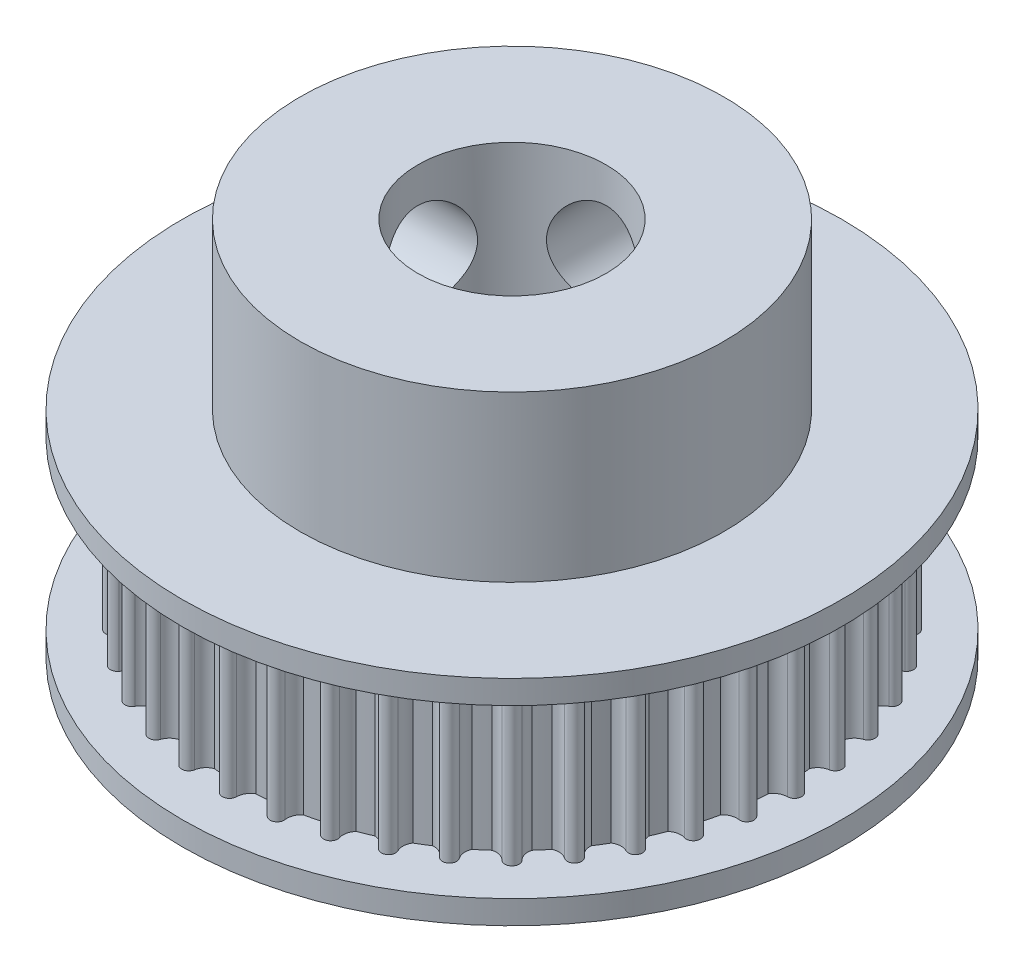
from build123d import *

# Parameters (mm, degrees)
SKETCH2_R               = 14
SKETCH2_R_2             = 4
BOSS_EXTRUDE1_DEPTH     = 15.5
CUT_EXTRUDE1_START      = -8.1
SKETCH3_R               = 14
CUT_EXTRUDE1_DEPTH      = 7.1
CUT_EXTRUDE2_REACH      = 27.145
CUT_EXTRUDE2_END_RADIUS = 14
SKETCH4_R               = 2
CUT_EXTRUDE3_REACH      = 27.145
CUT_EXTRUDE3_END_RADIUS = 14
SKETCH5_R               = 2
SKETCH6_R               = 9
SKETCH6_R_2             = 4
BOSS_EXTRUDE2_DEPTH     = 7
CUT_EXTRUDE4_REACH      = 31.971
CUT_EXTRUDE4_END_RADIUS = 9
SKETCH7_R               = 2
CUT_EXTRUDE5_REACH      = 31.971
CUT_EXTRUDE5_END_RADIUS = 9
SKETCH8_R               = 2
SKETCH9_R               = 14
CUT_EXTRUDE6_DEPTH      = 6.4


with BuildPart() as part:
    # Sketch2 → Boss-Extrude1 (new body)
    with BuildSketch(Plane(origin=(0, 0, 0), x_dir=(1, 0, 0), z_dir=(0, 1, 0))):
        with Locations(Location((0, 0, 0), (0, 0, 270))):
            Circle(SKETCH2_R)
        with Locations(Location((0, 0, 0), (0, 0, 270))):
            Circle(SKETCH2_R_2, mode=Mode.SUBTRACT)
    extrude(amount=BOSS_EXTRUDE1_DEPTH)

    # Sketch3 → Cut-Extrude1 (cut)
    with BuildSketch(Plane(origin=(0, 15.5, 0), x_dir=(1, 0, 0), z_dir=(0, 1, 0)).offset(CUT_EXTRUDE1_START)):
        with Locations(Location((0, 0, 0), (0, 0, 270))):
            Circle(SKETCH3_R)
        with BuildLine():
            ThreePointArc((-0.3, 12.001318591), (0, 12.300002898), (0.3, 12.001318591))
            ThreePointArc((0.3, 12.001318591), (0.381041187, 11.702811653), (0.6, 11.48433716))
            ThreePointArc((0.6, 11.48433716), (0.902279601, 11.464549338), (1.203933136, 11.436806591))
            ThreePointArc((1.203933136, 11.436806591), (1.454373143, 11.618338596), (1.581113351, 11.900492784))
            ThreePointArc((1.581113351, 11.900492784), (1.924144373, 12.148569451), (2.173726356, 11.806632105))
            ThreePointArc((2.173726356, 11.806632105), (2.207073018, 11.499122648), (2.389159144, 11.249085233))
            ThreePointArc((2.389159144, 11.249085233), (2.684621684, 11.182254085), (2.978221442, 11.107663888))
            ThreePointArc((2.978221442, 11.107663888), (3.253975979, 11.247783484), (3.423294445, 11.506637349))
            ThreePointArc((3.423294445, 11.506637349), (3.800909926, 11.697997906), (3.993928354, 11.321227152))
            ThreePointArc((3.993928354, 11.321227152), (3.978759387, 11.012287079), (4.119489261, 10.736843495))
            ThreePointArc((4.119489261, 10.736843495), (4.400859472, 10.624614624), (4.679176052, 10.505013635))
            ThreePointArc((4.679176052, 10.505013635), (4.973455127, 10.600270613), (5.181182667, 10.829450314))
            ThreePointArc((5.181182667, 10.829450314), (5.584084462, 10.959382829), (5.715786582, 10.557056014))
            ThreePointArc((5.715786582, 10.557056014), (5.652475495, 10.254292455), (5.748383881, 9.960225036))
            ThreePointArc((5.748383881, 9.960225036), (6.008733494, 9.80536189), (6.264913818, 9.643695083))
            ThreePointArc((6.264913818, 9.643695083), (6.570471304, 9.6917439), (6.811492978, 9.885606271))
            ThreePointArc((6.811492978, 9.885606271), (7.229760306, 9.950911375), (7.296903174, 9.532935119))
            ThreePointArc((7.296903174, 9.532935119), (7.187008896, 9.243803119), (7.235734212, 8.93835278))
            ThreePointArc((7.235734212, 8.93835278), (7.468652556, 8.744668604), (7.696388614, 8.544916752))
            ThreePointArc((7.696388614, 8.544916752), (8.005700672, 8.544574286), (8.274081725, 8.698345793))
            ThreePointArc((8.274081725, 8.698345793), (8.697415458, 8.697415458), (8.698345793, 8.274081725))
            ThreePointArc((8.698345793, 8.274081725), (8.544574286, 8.005700672), (8.544916752, 7.696388614))
            ThreePointArc((8.544916752, 7.696388614), (8.744668604, 7.468652556), (8.93835278, 7.235734212))
            ThreePointArc((8.93835278, 7.235734212), (9.243803119, 7.187008896), (9.532935119, 7.296903174))
            ThreePointArc((9.532935119, 7.296903174), (9.950911375, 7.229760306), (9.885606271, 6.811492978))
            ThreePointArc((9.885606271, 6.811492978), (9.6917439, 6.570471304), (9.643695083, 6.264913818))
            ThreePointArc((9.643695083, 6.264913818), (9.80536189, 6.008733494), (9.960225036, 5.748383881))
            ThreePointArc((9.960225036, 5.748383881), (10.254292455, 5.652475495), (10.557056014, 5.715786582))
            ThreePointArc((10.557056014, 5.715786582), (10.959382829, 5.584084462), (10.829450314, 5.181182667))
            ThreePointArc((10.829450314, 5.181182667), (10.600270613, 4.973455127), (10.505013635, 4.679176052))
            ThreePointArc((10.505013635, 4.679176052), (10.624614624, 4.400859472), (10.736843495, 4.119489261))
            ThreePointArc((10.736843495, 4.119489261), (11.012287079, 3.978759387), (11.321227152, 3.993928354))
            ThreePointArc((11.321227152, 3.993928354), (11.697997906, 3.800909926), (11.506637349, 3.423294445))
            ThreePointArc((11.506637349, 3.423294445), (11.247783484, 3.253975979), (11.107663888, 2.978221442))
            ThreePointArc((11.107663888, 2.978221442), (11.182254085, 2.684621684), (11.249085233, 2.389159144))
            ThreePointArc((11.249085233, 2.389159144), (11.499122648, 2.207073018), (11.806632105, 2.173726356))
            ThreePointArc((11.806632105, 2.173726356), (12.148569451, 1.924144373), (11.900492784, 1.581113351))
            ThreePointArc((11.900492784, 1.581113351), (11.618338596, 1.454373143), (11.436806591, 1.203933136))
            ThreePointArc((11.436806591, 1.203933136), (11.464549338, 0.902279601), (11.48433716, 0.6))
            ThreePointArc((11.48433716, 0.6), (11.702811653, 0.381041187), (12.001318591, 0.3))
            ThreePointArc((12.001318591, 0.3), (12.300002898, 0), (12.001318591, -0.3))
            ThreePointArc((12.001318591, -0.3), (11.702811653, -0.381041187), (11.48433716, -0.6))
            ThreePointArc((11.48433716, -0.6), (11.464549338, -0.902279601), (11.436806591, -1.203933136))
            ThreePointArc((11.436806591, -1.203933136), (11.618338596, -1.454373143), (11.900492784, -1.581113351))
            ThreePointArc((11.900492784, -1.581113351), (12.148569451, -1.924144373), (11.806632105, -2.173726356))
            ThreePointArc((11.806632105, -2.173726356), (11.499122648, -2.207073018), (11.249085233, -2.389159144))
            ThreePointArc((11.249085233, -2.389159144), (11.182254085, -2.684621684), (11.107663888, -2.978221442))
            ThreePointArc((11.107663888, -2.978221442), (11.247783484, -3.253975979), (11.506637349, -3.423294445))
            ThreePointArc((11.506637349, -3.423294445), (11.697997906, -3.800909926), (11.321227152, -3.993928354))
            ThreePointArc((11.321227152, -3.993928354), (11.012287079, -3.978759387), (10.736843495, -4.119489261))
            ThreePointArc((10.736843495, -4.119489261), (10.624614624, -4.400859472), (10.505013635, -4.679176052))
            ThreePointArc((10.505013635, -4.679176052), (10.600270613, -4.973455127), (10.829450314, -5.181182667))
            ThreePointArc((10.829450314, -5.181182667), (10.959382829, -5.584084462), (10.557056014, -5.715786582))
            ThreePointArc((10.557056014, -5.715786582), (10.254292455, -5.652475495), (9.960225036, -5.748383881))
            ThreePointArc((9.960225036, -5.748383881), (9.80536189, -6.008733494), (9.643695083, -6.264913818))
            ThreePointArc((9.643695083, -6.264913818), (9.6917439, -6.570471304), (9.885606271, -6.811492978))
            ThreePointArc((9.885606271, -6.811492978), (9.950911375, -7.229760306), (9.532935119, -7.296903174))
            ThreePointArc((9.532935119, -7.296903174), (9.243803119, -7.187008896), (8.93835278, -7.235734212))
            ThreePointArc((8.93835278, -7.235734212), (8.744668604, -7.468652556), (8.544916752, -7.696388614))
            ThreePointArc((8.544916752, -7.696388614), (8.544574286, -8.005700672), (8.698345793, -8.274081725))
            ThreePointArc((8.698345793, -8.274081725), (8.697415458, -8.697415458), (8.274081725, -8.698345793))
            ThreePointArc((8.274081725, -8.698345793), (8.005700672, -8.544574286), (7.696388614, -8.544916752))
            ThreePointArc((7.696388614, -8.544916752), (7.468652556, -8.744668604), (7.235734212, -8.93835278))
            ThreePointArc((7.235734212, -8.93835278), (7.187008896, -9.243803119), (7.296903174, -9.532935119))
            ThreePointArc((7.296903174, -9.532935119), (7.229760306, -9.950911375), (6.811492978, -9.885606271))
            ThreePointArc((6.811492978, -9.885606271), (6.570471304, -9.6917439), (6.264913818, -9.643695083))
            ThreePointArc((6.264913818, -9.643695083), (6.008733494, -9.80536189), (5.748383881, -9.960225036))
            ThreePointArc((5.748383881, -9.960225036), (5.652475495, -10.254292455), (5.715786582, -10.557056014))
            ThreePointArc((5.715786582, -10.557056014), (5.584084462, -10.959382829), (5.181182667, -10.829450314))
            ThreePointArc((5.181182667, -10.829450314), (4.973455127, -10.600270613), (4.679176052, -10.505013635))
            ThreePointArc((4.679176052, -10.505013635), (4.400859472, -10.624614624), (4.119489261, -10.736843495))
            ThreePointArc((4.119489261, -10.736843495), (3.978759387, -11.012287079), (3.993928354, -11.321227152))
            ThreePointArc((3.993928354, -11.321227152), (3.800909926, -11.697997906), (3.423294445, -11.506637349))
            ThreePointArc((3.423294445, -11.506637349), (3.253975979, -11.247783484), (2.978221442, -11.107663888))
            ThreePointArc((2.978221442, -11.107663888), (2.684621684, -11.182254085), (2.389159144, -11.249085233))
            ThreePointArc((2.389159144, -11.249085233), (2.207073018, -11.499122648), (2.173726356, -11.806632105))
            ThreePointArc((2.173726356, -11.806632105), (1.924144373, -12.148569451), (1.581113351, -11.900492784))
            ThreePointArc((1.581113351, -11.900492784), (1.454373143, -11.618338596), (1.203933136, -11.436806591))
            ThreePointArc((1.203933136, -11.436806591), (0.902279601, -11.464549338), (0.6, -11.48433716))
            ThreePointArc((0.6, -11.48433716), (0.381041187, -11.702811653), (0.3, -12.001318591))
            ThreePointArc((0.3, -12.001318591), (0, -12.300002898), (-0.3, -12.001318591))
            ThreePointArc((-0.3, -12.001318591), (-0.381041187, -11.702811653), (-0.6, -11.48433716))
            ThreePointArc((-0.6, -11.48433716), (-0.902279601, -11.464549338), (-1.203933136, -11.436806591))
            ThreePointArc((-1.203933136, -11.436806591), (-1.454373143, -11.618338596), (-1.581113351, -11.900492784))
            ThreePointArc((-1.581113351, -11.900492784), (-1.924144373, -12.148569451), (-2.173726356, -11.806632105))
            ThreePointArc((-2.173726356, -11.806632105), (-2.207073018, -11.499122648), (-2.389159144, -11.249085233))
            ThreePointArc((-2.389159144, -11.249085233), (-2.684621684, -11.182254085), (-2.978221442, -11.107663888))
            ThreePointArc((-2.978221442, -11.107663888), (-3.253975979, -11.247783484), (-3.423294445, -11.506637349))
            ThreePointArc((-3.423294445, -11.506637349), (-3.800909926, -11.697997906), (-3.993928354, -11.321227152))
            ThreePointArc((-3.993928354, -11.321227152), (-3.978759387, -11.012287079), (-4.119489261, -10.736843495))
            ThreePointArc((-4.119489261, -10.736843495), (-4.400859472, -10.624614624), (-4.679176052, -10.505013635))
            ThreePointArc((-4.679176052, -10.505013635), (-4.973455127, -10.600270613), (-5.181182667, -10.829450314))
            ThreePointArc((-5.181182667, -10.829450314), (-5.584084462, -10.959382829), (-5.715786582, -10.557056014))
            ThreePointArc((-5.715786582, -10.557056014), (-5.652475495, -10.254292455), (-5.748383881, -9.960225036))
            ThreePointArc((-5.748383881, -9.960225036), (-6.008733494, -9.80536189), (-6.264913818, -9.643695083))
            ThreePointArc((-6.264913818, -9.643695083), (-6.570471304, -9.6917439), (-6.811492978, -9.885606271))
            ThreePointArc((-6.811492978, -9.885606271), (-7.229760306, -9.950911375), (-7.296903174, -9.532935119))
            ThreePointArc((-7.296903174, -9.532935119), (-7.187008896, -9.243803119), (-7.235734212, -8.93835278))
            ThreePointArc((-7.235734212, -8.93835278), (-7.468652556, -8.744668604), (-7.696388614, -8.544916752))
            ThreePointArc((-7.696388614, -8.544916752), (-8.005700672, -8.544574286), (-8.274081725, -8.698345793))
            ThreePointArc((-8.274081725, -8.698345793), (-8.697415458, -8.697415458), (-8.698345793, -8.274081725))
            ThreePointArc((-8.698345793, -8.274081725), (-8.544574286, -8.005700672), (-8.544916752, -7.696388614))
            ThreePointArc((-8.544916752, -7.696388614), (-8.744668604, -7.468652556), (-8.93835278, -7.235734212))
            ThreePointArc((-8.93835278, -7.235734212), (-9.243803119, -7.187008896), (-9.532935119, -7.296903174))
            ThreePointArc((-9.532935119, -7.296903174), (-9.950911375, -7.229760306), (-9.885606271, -6.811492978))
            ThreePointArc((-9.885606271, -6.811492978), (-9.6917439, -6.570471304), (-9.643695083, -6.264913818))
            ThreePointArc((-9.643695083, -6.264913818), (-9.80536189, -6.008733494), (-9.960225036, -5.748383881))
            ThreePointArc((-9.960225036, -5.748383881), (-10.254292455, -5.652475495), (-10.557056014, -5.715786582))
            ThreePointArc((-10.557056014, -5.715786582), (-10.959382829, -5.584084462), (-10.829450314, -5.181182667))
            ThreePointArc((-10.829450314, -5.181182667), (-10.600270613, -4.973455127), (-10.505013635, -4.679176052))
            ThreePointArc((-10.505013635, -4.679176052), (-10.624614624, -4.400859472), (-10.736843495, -4.119489261))
            ThreePointArc((-10.736843495, -4.119489261), (-11.012287079, -3.978759387), (-11.321227152, -3.993928354))
            ThreePointArc((-11.321227152, -3.993928354), (-11.697997906, -3.800909926), (-11.506637349, -3.423294445))
            ThreePointArc((-11.506637349, -3.423294445), (-11.247783484, -3.253975979), (-11.107663888, -2.978221442))
            ThreePointArc((-11.107663888, -2.978221442), (-11.182254085, -2.684621684), (-11.249085233, -2.389159144))
            ThreePointArc((-11.249085233, -2.389159144), (-11.499122648, -2.207073018), (-11.806632105, -2.173726356))
            ThreePointArc((-11.806632105, -2.173726356), (-12.148569451, -1.924144373), (-11.900492784, -1.581113351))
            ThreePointArc((-11.900492784, -1.581113351), (-11.618338596, -1.454373143), (-11.436806591, -1.203933136))
            ThreePointArc((-11.436806591, -1.203933136), (-11.464549338, -0.902279601), (-11.48433716, -0.6))
            ThreePointArc((-11.48433716, -0.6), (-11.702811653, -0.381041187), (-12.001318591, -0.3))
            ThreePointArc((-12.001318591, -0.3), (-12.300002898, 0), (-12.001318591, 0.3))
            ThreePointArc((-12.001318591, 0.3), (-11.702811653, 0.381041187), (-11.48433716, 0.6))
            ThreePointArc((-11.48433716, 0.6), (-11.464549338, 0.902279601), (-11.436806591, 1.203933136))
            ThreePointArc((-11.436806591, 1.203933136), (-11.618338596, 1.454373143), (-11.900492784, 1.581113351))
            ThreePointArc((-11.900492784, 1.581113351), (-12.148569451, 1.924144373), (-11.806632105, 2.173726356))
            ThreePointArc((-11.806632105, 2.173726356), (-11.499122648, 2.207073018), (-11.249085233, 2.389159144))
            ThreePointArc((-11.249085233, 2.389159144), (-11.182254085, 2.684621684), (-11.107663888, 2.978221442))
            ThreePointArc((-11.107663888, 2.978221442), (-11.247783484, 3.253975979), (-11.506637349, 3.423294445))
            ThreePointArc((-11.506637349, 3.423294445), (-11.697997906, 3.800909926), (-11.321227152, 3.993928354))
            ThreePointArc((-11.321227152, 3.993928354), (-11.012287079, 3.978759387), (-10.736843495, 4.119489261))
            ThreePointArc((-10.736843495, 4.119489261), (-10.624614624, 4.400859472), (-10.505013635, 4.679176052))
            ThreePointArc((-10.505013635, 4.679176052), (-10.600270613, 4.973455127), (-10.829450314, 5.181182667))
            ThreePointArc((-10.829450314, 5.181182667), (-10.959382829, 5.584084462), (-10.557056014, 5.715786582))
            ThreePointArc((-10.557056014, 5.715786582), (-10.254292455, 5.652475495), (-9.960225036, 5.748383881))
            ThreePointArc((-9.960225036, 5.748383881), (-9.80536189, 6.008733494), (-9.643695083, 6.264913818))
            ThreePointArc((-9.643695083, 6.264913818), (-9.6917439, 6.570471304), (-9.885606271, 6.811492978))
            ThreePointArc((-9.885606271, 6.811492978), (-9.950911375, 7.229760306), (-9.532935119, 7.296903174))
            ThreePointArc((-9.532935119, 7.296903174), (-9.243803119, 7.187008896), (-8.93835278, 7.235734212))
            ThreePointArc((-8.93835278, 7.235734212), (-8.744668604, 7.468652556), (-8.544916752, 7.696388614))
            ThreePointArc((-8.544916752, 7.696388614), (-8.544574286, 8.005700672), (-8.698345793, 8.274081725))
            ThreePointArc((-8.698345793, 8.274081725), (-8.697415458, 8.697415458), (-8.274081725, 8.698345793))
            ThreePointArc((-8.274081725, 8.698345793), (-8.005700672, 8.544574286), (-7.696388614, 8.544916752))
            ThreePointArc((-7.696388614, 8.544916752), (-7.468652556, 8.744668604), (-7.235734212, 8.93835278))
            ThreePointArc((-7.235734212, 8.93835278), (-7.187008896, 9.243803119), (-7.296903174, 9.532935119))
            ThreePointArc((-7.296903174, 9.532935119), (-7.229760306, 9.950911375), (-6.811492978, 9.885606271))
            ThreePointArc((-6.811492978, 9.885606271), (-6.570471304, 9.6917439), (-6.264913818, 9.643695083))
            ThreePointArc((-6.264913818, 9.643695083), (-6.008733494, 9.80536189), (-5.748383881, 9.960225036))
            ThreePointArc((-5.748383881, 9.960225036), (-5.652475495, 10.254292455), (-5.715786582, 10.557056014))
            ThreePointArc((-5.715786582, 10.557056014), (-5.584084462, 10.959382829), (-5.181182667, 10.829450314))
            ThreePointArc((-5.181182667, 10.829450314), (-4.973455127, 10.600270613), (-4.679176052, 10.505013635))
            ThreePointArc((-4.679176052, 10.505013635), (-4.400859472, 10.624614624), (-4.119489261, 10.736843495))
            ThreePointArc((-4.119489261, 10.736843495), (-3.978759387, 11.012287079), (-3.993928354, 11.321227152))
            ThreePointArc((-3.993928354, 11.321227152), (-3.800909926, 11.697997906), (-3.423294445, 11.506637349))
            ThreePointArc((-3.423294445, 11.506637349), (-3.253975979, 11.247783484), (-2.978221442, 11.107663888))
            ThreePointArc((-2.978221442, 11.107663888), (-2.684621684, 11.182254085), (-2.389159144, 11.249085233))
            ThreePointArc((-2.389159144, 11.249085233), (-2.207073018, 11.499122648), (-2.173726356, 11.806632105))
            ThreePointArc((-2.173726356, 11.806632105), (-1.924144373, 12.148569451), (-1.581113351, 11.900492784))
            ThreePointArc((-1.581113351, 11.900492784), (-1.454373143, 11.618338596), (-1.203933136, 11.436806591))
            ThreePointArc((-1.203933136, 11.436806591), (-0.902279601, 11.464549338), (-0.6, 11.48433716))
            ThreePointArc((-0.6, 11.48433716), (-0.381041187, 11.702811653), (-0.3, 12.001318591))
        make_face(mode=Mode.SUBTRACT)
    extrude(amount=CUT_EXTRUDE1_DEPTH, mode=Mode.SUBTRACT)

    # Cut-Extrude2: up to this cylinder (the profile starts inside it)
    cut_extrude2_end = Plane(origin=(0, 3.75, 0), z_dir=(0, -1, 0)) * Cylinder(CUT_EXTRUDE2_END_RADIUS, 83.29, mode=Mode.PRIVATE)
    # Sketch4 → Cut-Extrude2 (cut, up to the surface)
    with BuildSketch(Plane.XY, mode=Mode.PRIVATE) as cut_extrude2_sk1:
        with Locations((0, 3.75)):
            Circle(SKETCH4_R)
    cut_extrude2_tool1 = extrude(cut_extrude2_sk1.sketch, amount=-CUT_EXTRUDE2_REACH, mode=Mode.PRIVATE) & cut_extrude2_end
    add(cut_extrude2_tool1.solids().sort_by_distance((0, 3.75, 0))[0], mode=Mode.SUBTRACT)

    # Cut-Extrude3: up to this cylinder (the profile starts inside it)
    cut_extrude3_end = Plane(origin=(0, 3.75, 0), z_dir=(0, -1, 0)) * Cylinder(CUT_EXTRUDE3_END_RADIUS, 83.29, mode=Mode.PRIVATE)
    # Sketch5 → Cut-Extrude3 (cut, up to the surface)
    with BuildSketch(Plane(origin=(0, 0, 0), x_dir=(0, 0, -1), z_dir=(1, 0, 0)), mode=Mode.PRIVATE) as cut_extrude3_sk1:
        with Locations((0, 3.75)):
            Circle(SKETCH5_R)
    cut_extrude3_tool1 = extrude(cut_extrude3_sk1.sketch, amount=-CUT_EXTRUDE3_REACH, mode=Mode.PRIVATE) & cut_extrude3_end
    add(cut_extrude3_tool1.solids().sort_by_distance((0, 3.75, 0))[0], mode=Mode.SUBTRACT)

    # Sketch6 → Boss-Extrude2 (add)
    with BuildSketch(Plane(origin=(0, 15.5, 0), x_dir=(1, 0, 0), z_dir=(0, 1, 0))):
        with Locations(Location((0, 0, 0), (0, 0, 270))):
            Circle(SKETCH6_R)
        with Locations(Location((0, 0, 0), (0, 0, 270))):
            Circle(SKETCH6_R_2, mode=Mode.SUBTRACT)
    extrude(amount=BOSS_EXTRUDE2_DEPTH)

    # Cut-Extrude4: up to this cylinder (the profile starts inside it)
    cut_extrude4_end = Plane(origin=(0, 19, 0), z_dir=(0, -1, 0)) * Cylinder(CUT_EXTRUDE4_END_RADIUS, 82.942, mode=Mode.PRIVATE)
    # Sketch7 → Cut-Extrude4 (cut, up to the surface)
    with BuildSketch(Plane.XY, mode=Mode.PRIVATE) as cut_extrude4_sk1:
        with Locations((0, 19)):
            Circle(SKETCH7_R)
    cut_extrude4_tool1 = extrude(cut_extrude4_sk1.sketch, amount=-CUT_EXTRUDE4_REACH, mode=Mode.PRIVATE) & cut_extrude4_end
    add(cut_extrude4_tool1.solids().sort_by_distance((0, 19, 0))[0], mode=Mode.SUBTRACT)

    # Cut-Extrude5: up to this cylinder (the profile starts inside it)
    cut_extrude5_end = Plane(origin=(0, 19, 0), z_dir=(0, -1, 0)) * Cylinder(CUT_EXTRUDE5_END_RADIUS, 82.942, mode=Mode.PRIVATE)
    # Sketch8 → Cut-Extrude5 (cut, up to the surface)
    with BuildSketch(Plane(origin=(0, 0, 0), x_dir=(0, 0, -1), z_dir=(1, 0, 0)), mode=Mode.PRIVATE) as cut_extrude5_sk1:
        with Locations((0, 19)):
            Circle(SKETCH8_R)
    cut_extrude5_tool1 = extrude(cut_extrude5_sk1.sketch, amount=-CUT_EXTRUDE5_REACH, mode=Mode.PRIVATE) & cut_extrude5_end
    add(cut_extrude5_tool1.solids().sort_by_distance((0, 19, 0))[0], mode=Mode.SUBTRACT)

    # Sketch9 → Cut-Extrude6 (cut)
    with BuildSketch(Plane.XZ):
        with Locations(Location((0, 0, 0), (0, 0, 270))):
            Circle(SKETCH9_R)
    extrude(amount=-CUT_EXTRUDE6_DEPTH, mode=Mode.SUBTRACT)


solid = part.part
